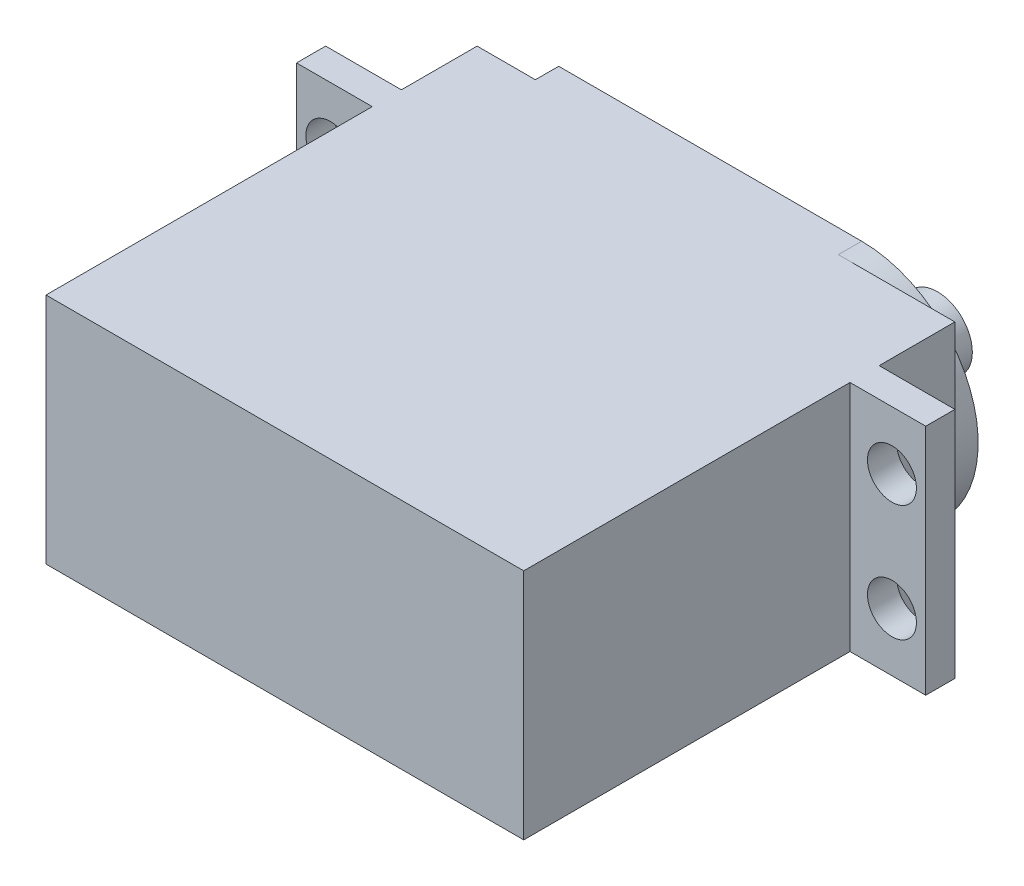
from build123d import *

# Parameters (mm, degrees)
SKETCH_1_W                  = 54
SKETCH_1_H                  = 39
EXTRUDE_1_DEPTH             = 20
SKETCH_2_W                  = 6.5
SKETCH_2_H                  = 28
CUT_EXTRUDE_1_DEPTH         = 42.003048667
SKETCH_3_W                  = 6.5
SKETCH_3_H                  = 28
CUT_EXTRUDE_2_DEPTH         = 42.003048667
SKETCH_4_W                  = 6.5
SKETCH_4_H                  = 8.5
CUT_EXTRUDE_3_DEPTH         = 42.003048667
SKETCH_5_W                  = 5
SKETCH_5_H                  = 2
CUT_EXTRUDE_4_DEPTH         = 42.003048667
CUT_EXTRUDE_5_DEPTH         = 2
SKETCH_7_W                  = 6.5
SKETCH_7_H                  = 6.5
CUT_EXTRUDE_6_DEPTH         = 42.003048667
HOLE_WIZARD_4_2_4_2_1_D     = 4.2
HOLE_WIZARD_4_2_4_2_1_DEPTH = 30.5


with BuildPart() as part:
    # 草图1 → 凸台-拉伸1 (new body)
    with BuildSketch(Plane.XZ.offset(50)):
        with Locations((0, 4)):
            Rectangle(SKETCH_1_W, SKETCH_1_H)
    extrude(amount=-EXTRUDE_1_DEPTH)

    # 草图2 → 切除-拉伸1 (cut, through all)
    with BuildSketch(Plane(origin=(0, -30, 0), x_dir=(-1, 0, 0), z_dir=(0, 1, 0))):
        with Locations((-23.75, 9.5)):
            Rectangle(SKETCH_2_W, SKETCH_2_H)
    extrude(amount=-CUT_EXTRUDE_1_DEPTH, mode=Mode.SUBTRACT)

    # 草图3 → 切除-拉伸2 (cut, through all)
    with BuildSketch(Plane(origin=(0, -30, 0), x_dir=(-1, 0, 0), z_dir=(0, 1, 0))):
        with Locations((23.75, 9.5)):
            Rectangle(SKETCH_3_W, SKETCH_3_H)
    extrude(amount=-CUT_EXTRUDE_2_DEPTH, mode=Mode.SUBTRACT)

    # 草图4 → 切除-拉伸3 (cut, through all)
    with BuildSketch(Plane(origin=(0, -30, 0), x_dir=(-1, 0, 0), z_dir=(0, 1, 0))):
        with Locations((23.75, -11.25)):
            Rectangle(SKETCH_4_W, SKETCH_4_H)
    extrude(amount=-CUT_EXTRUDE_3_DEPTH, mode=Mode.SUBTRACT)

    # 草图5 → 切除-拉伸4 (cut, through all)
    with BuildSketch(Plane(origin=(0, -30, 0), x_dir=(-1, 0, 0), z_dir=(0, 1, 0))):
        with Locations((18, -14.5)):
            Rectangle(SKETCH_5_W, SKETCH_5_H)
    extrude(amount=-CUT_EXTRUDE_4_DEPTH, mode=Mode.SUBTRACT)

    # 草图6 → 切除-拉伸5 (cut)
    with BuildSketch(Plane(origin=(0, 0, -15.5), x_dir=(-1, 0, 0), z_dir=(0, 0, -1))):
        with BuildLine():
            Line((-10.5, -30), (-27, -30))
            Line((-27, -30), (-27, -50))
            Line((-27, -50), (-10.5, -50))
            ThreePointArc((-10.5, -50), (-20.5, -40), (-10.5, -30))
        make_face()
    extrude(amount=-CUT_EXTRUDE_5_DEPTH, mode=Mode.SUBTRACT)

    # 草图7 → 切除-拉伸6 (cut, through all)
    with BuildSketch(Plane(origin=(0, -30, 0), x_dir=(-1, 0, 0), z_dir=(0, 1, 0))):
        with Locations((-23.75, -10.25)):
            Rectangle(SKETCH_7_W, SKETCH_7_H)
    extrude(amount=-CUT_EXTRUDE_6_DEPTH, mode=Mode.SUBTRACT)

    # 草图8 → 旋转1 (revolve)
    with BuildSketch(Plane(origin=(0, -40, 0), x_dir=(1, 0, 0), z_dir=(0, 1, 0))):
        Polygon((13.5, 22), (10.5, 22), (10.5, 15.5), (17, 15.5), (17, 17), (13.5, 17), align=None)
    revolve(axis=Axis((10.5, -40, -22), (0, 0, 1)))

    # Ø4.2 (4.2) 直径孔1
    with Locations(Plane(origin=(0, 0, -7), x_dir=(-1, 0, 0), z_dir=(0, 0, -1))):
        with Locations((24.1, -45), (24.1, -35), (-24.1, -45), (-24.1, -35)):
            Hole(HOLE_WIZARD_4_2_4_2_1_D / 2, depth=HOLE_WIZARD_4_2_4_2_1_DEPTH)


solid = part.part
